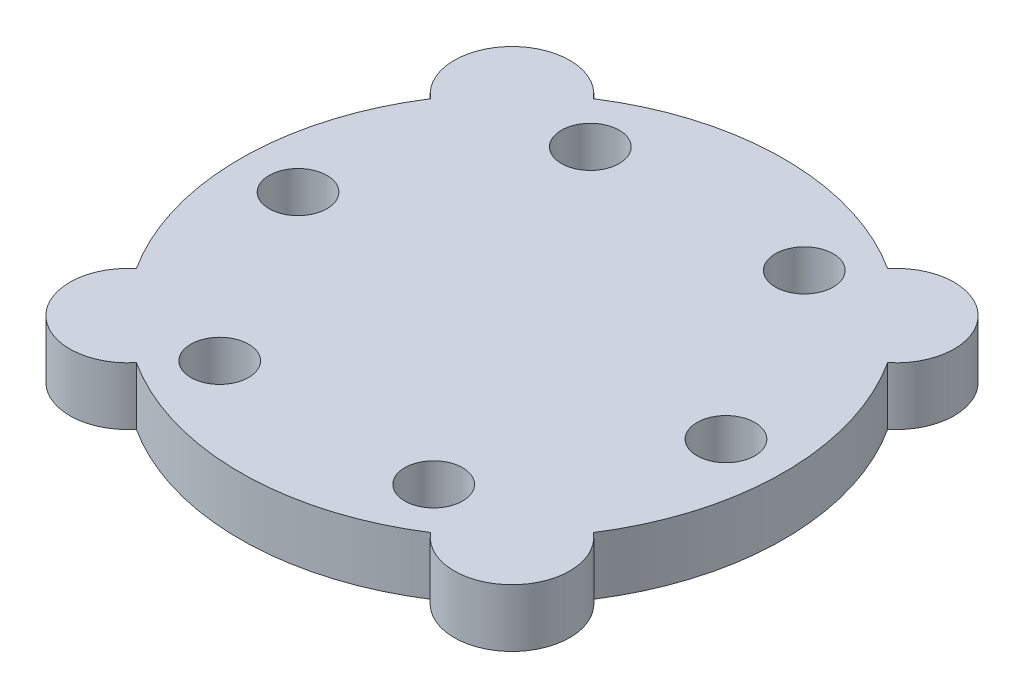
from build123d import *

# Parameters (mm, degrees)
BOSS_EXTRUDE1_DEPTH = 0.25
CUT_EXTRUDE1_REACH  = 5.361
SKETCH2_R           = 0.25


with BuildPart() as part:
    # Sketch1 → Boss-Extrude1 (new, symmetric)
    with BuildSketch(Plane(origin=(0, 0, 0), x_dir=(1, 0, 0), z_dir=(0, 1, 0))):
        with BuildLine():
            ThreePointArc((-1.975635929, 1.272541817), (-2.35, 0), (-1.975635929, -1.272541817))
            ThreePointArc((-1.975635929, -1.272541817), (-2.015254326, -2.015254326), (-1.272541817, -1.975635929))
            ThreePointArc((-1.272541817, -1.975635929), (0, -2.35), (1.272541817, -1.975635929))
            ThreePointArc((1.272541817, -1.975635929), (2.015254326, -2.015254326), (1.975635929, -1.272541817))
            ThreePointArc((1.975635929, -1.272541817), (2.35, 0), (1.975635929, 1.272541817))
            ThreePointArc((1.975635929, 1.272541817), (2.015254326, 2.015254326), (1.272541817, 1.975635929))
            ThreePointArc((1.272541817, 1.975635929), (0, 2.35), (-1.272541817, 1.975635929))
            ThreePointArc((-1.272541817, 1.975635929), (-2.015254326, 2.015254326), (-1.975635929, 1.272541817))
        make_face()
    extrude(amount=BOSS_EXTRUDE1_DEPTH, both=True)

    # Sketch2 → Cut-Extrude1 (cut, up to next)
    with BuildSketch(Plane(origin=(0, 0.25, 0), x_dir=(1, 0, 0), z_dir=(0, 1, 0)), mode=Mode.PRIVATE) as cut_extrude1_sk1:
        with Locations(Location((-1.85, 0, 0), (0, 0, 270))):
            Circle(SKETCH2_R)
    cut_extrude1_tool1 = extrude(cut_extrude1_sk1.sketch, amount=-CUT_EXTRUDE1_REACH, mode=Mode.PRIVATE) & part.part
    # Sketch2 → Cut-Extrude1 (cut, up to next)
    with BuildSketch(Plane(origin=(0, 0.25, 0), x_dir=(1, 0, 0), z_dir=(0, 1, 0)), mode=Mode.PRIVATE) as cut_extrude1_sk2:
        with Locations(Location((-0.925, 1.602146997, 0), (0, 0, 270))):
            Circle(SKETCH2_R)
    cut_extrude1_tool2 = extrude(cut_extrude1_sk2.sketch, amount=-CUT_EXTRUDE1_REACH, mode=Mode.PRIVATE) & part.part
    # Sketch2 → Cut-Extrude1 (cut, up to next)
    with BuildSketch(Plane(origin=(0, 0.25, 0), x_dir=(1, 0, 0), z_dir=(0, 1, 0)), mode=Mode.PRIVATE) as cut_extrude1_sk3:
        with Locations(Location((0.925, 1.602146997, 0), (0, 0, 270))):
            Circle(SKETCH2_R)
    cut_extrude1_tool3 = extrude(cut_extrude1_sk3.sketch, amount=-CUT_EXTRUDE1_REACH, mode=Mode.PRIVATE) & part.part
    # Sketch2 → Cut-Extrude1 (cut, up to next)
    with BuildSketch(Plane(origin=(0, 0.25, 0), x_dir=(1, 0, 0), z_dir=(0, 1, 0)), mode=Mode.PRIVATE) as cut_extrude1_sk4:
        with Locations(Location((1.85, 0, 0), (0, 0, 270))):
            Circle(SKETCH2_R)
    cut_extrude1_tool4 = extrude(cut_extrude1_sk4.sketch, amount=-CUT_EXTRUDE1_REACH, mode=Mode.PRIVATE) & part.part
    # Sketch2 → Cut-Extrude1 (cut, up to next)
    with BuildSketch(Plane(origin=(0, 0.25, 0), x_dir=(1, 0, 0), z_dir=(0, 1, 0)), mode=Mode.PRIVATE) as cut_extrude1_sk5:
        with Locations(Location((0.925, -1.602146997, 0), (0, 0, 270))):
            Circle(SKETCH2_R)
    cut_extrude1_tool5 = extrude(cut_extrude1_sk5.sketch, amount=-CUT_EXTRUDE1_REACH, mode=Mode.PRIVATE) & part.part
    # Sketch2 → Cut-Extrude1 (cut, up to next)
    with BuildSketch(Plane(origin=(0, 0.25, 0), x_dir=(1, 0, 0), z_dir=(0, 1, 0)), mode=Mode.PRIVATE) as cut_extrude1_sk6:
        with Locations(Location((-0.925, -1.602146997, 0), (0, 0, 270))):
            Circle(SKETCH2_R)
    cut_extrude1_tool6 = extrude(cut_extrude1_sk6.sketch, amount=-CUT_EXTRUDE1_REACH, mode=Mode.PRIVATE) & part.part
    add(cut_extrude1_tool1.solids().sort_by_distance((-1.85, 0.25, 0))[0], mode=Mode.SUBTRACT)
    add(cut_extrude1_tool2.solids().sort_by_distance((-0.925, 0.25, -1.602147))[0], mode=Mode.SUBTRACT)
    add(cut_extrude1_tool3.solids().sort_by_distance((0.925, 0.25, -1.602147))[0], mode=Mode.SUBTRACT)
    add(cut_extrude1_tool4.solids().sort_by_distance((1.85, 0.25, 0))[0], mode=Mode.SUBTRACT)
    add(cut_extrude1_tool5.solids().sort_by_distance((0.925, 0.25, 1.602147))[0], mode=Mode.SUBTRACT)
    add(cut_extrude1_tool6.solids().sort_by_distance((-0.925, 0.25, 1.602147))[0], mode=Mode.SUBTRACT)


solid = part.part
